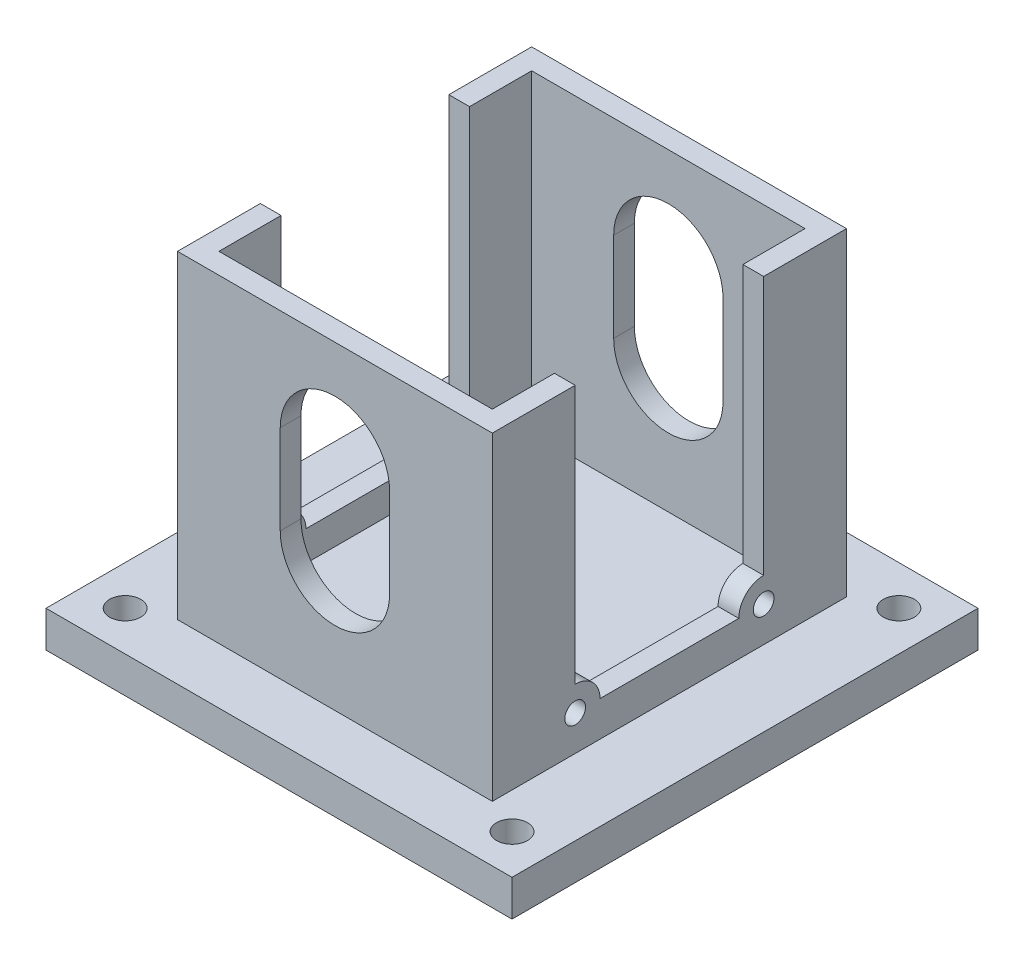
from build123d import *

# Parameters (mm, degrees)
EXTRUDE_1_DEPTH      = 15.2
EXTRUDE_1_DEPTH_BACK = 15.2
SKETCH_1_R           = 1
SKETCH_2_W           = 26.4
SKETCH_2_H           = 30.2
CUT_EXTRUDE_1_DEPTH  = 30.3
CUT_EXTRUDE_2_REACH  = 48.384
EXTRUDE_2_DEPTH      = 2
EXTRUDE_2_DEPTH_BACK = 1.5
SKETCH_4_W           = 45
SKETCH_4_H           = 45
SKETCH_5_R           = 1.5
CUT_EXTRUDE_3_DEPTH  = 3.5


with BuildPart() as part:
    # 草图1 → 凸台-拉伸1 (new, two sides: drawn at the far end of the back side and taken through both)
    with BuildSketch(Plane(origin=(0, 0, 0), x_dir=(0, 0, -1), z_dir=(1, 0, 0)).offset(-EXTRUDE_1_DEPTH_BACK)):
        with BuildLine():
            Line((-6.7, 0), (6.7, 0))
            ThreePointArc((6.7, 0), (7.402943725, 1.697056275), (9.1, 2.4))
            Line((9.1, 2.4), (9.1, 27.4))
            Line((9.1, 27.4), (17.1, 27.4))
            Line((17.1, 27.4), (17.1, 0))
            Line((17.1, 0), (17.1, -4.9))
            Line((17.1, -4.9), (9.1, -4.9))
            Line((9.1, -4.9), (-9.1, -4.9))
            Line((-9.1, -4.9), (-17.1, -4.9))
            Line((-17.1, -4.9), (-17.1, 0))
            Line((-17.1, 0), (-17.1, 27.4))
            Line((-17.1, 27.4), (-9.1, 27.4))
            Line((-9.1, 27.4), (-9.1, 2.4))
            ThreePointArc((-9.1, 2.4), (-7.402943725, 1.697056275), (-6.7, 0))
        make_face()
        with Locations((9.1, 0)):
            Circle(SKETCH_1_R, mode=Mode.SUBTRACT)
        with Locations((-9.1, 0)):
            Circle(SKETCH_1_R, mode=Mode.SUBTRACT)
    extrude(amount=EXTRUDE_1_DEPTH + EXTRUDE_1_DEPTH_BACK)

    # 草图2 → 切除-拉伸1 (cut)
    with BuildSketch(Plane(origin=(0, 27.4, 0), x_dir=(1, 0, 0), z_dir=(0, 1, 0))):
        Rectangle(SKETCH_2_W, SKETCH_2_H)
    extrude(amount=-CUT_EXTRUDE_1_DEPTH, mode=Mode.SUBTRACT)

    # 切除-拉伸2: up to this face of the body (flat: up to its plane)
    cut_extrude_2_end = Plane(part.part.faces().sort_by_distance((0, 11.25, 17.1))[0])
    # 草图3 → 切除-拉伸2 (cut, up to the picked face)
    with BuildSketch(Plane(origin=(0, 0, -17.1), x_dir=(-1, 0, 0), z_dir=(0, 0, -1)), mode=Mode.PRIVATE) as cut_extrude_2_sk1:
        with BuildLine():
            Line((5.280872039, 17.60905008), (5.280872039, 8.98362575))
            ThreePointArc((5.280872039, 8.98362575), (0, 3.702753711), (-5.280872039, 8.98362575))
            Line((-5.280872039, 8.98362575), (-5.280872039, 17.60905008))
            ThreePointArc((-5.280872039, 17.60905008), (0, 22.889922119), (5.280872039, 17.60905008))
        make_face()
    cut_extrude_2_tool1 = split(extrude(cut_extrude_2_sk1.sketch, amount=-CUT_EXTRUDE_2_REACH, mode=Mode.PRIVATE), bisect_by=cut_extrude_2_end, keep=Keep.BOTH, mode=Mode.PRIVATE)
    add(cut_extrude_2_tool1.solids().sort_by(Axis((0, 13.296338, -17.1), (0, 0, 1)))[0], mode=Mode.SUBTRACT)

    # 草图4 → 凸台-拉伸2 (add, two sides: drawn at the far end of the back side and taken through both)
    with BuildSketch(Plane.XZ.offset(4.9).offset(-EXTRUDE_2_DEPTH_BACK)):
        Rectangle(SKETCH_4_W, SKETCH_4_H)
    extrude(amount=EXTRUDE_2_DEPTH + EXTRUDE_2_DEPTH_BACK)

    # 草图5 → 切除-拉伸3 (cut)
    with BuildSketch(Plane(origin=(0, -3.4, 0), x_dir=(1, 0, 0), z_dir=(0, 1, 0))):
        with Locations(Location((-18.679189152, 18.679189152, 0), (0, 0, 270))):
            Circle(SKETCH_5_R)
        with Locations(Location((18.679189152, 18.679189152, 0), (0, 0, 90))):
            Circle(SKETCH_5_R)
        with Locations(Location((-18.679189152, -18.679189152, 0), (0, 0, 90))):
            Circle(SKETCH_5_R)
        with Locations(Location((18.679189152, -18.679189152, 0), (0, 0, 270))):
            Circle(SKETCH_5_R)
    extrude(amount=-CUT_EXTRUDE_3_DEPTH, mode=Mode.SUBTRACT)


solid = part.part
